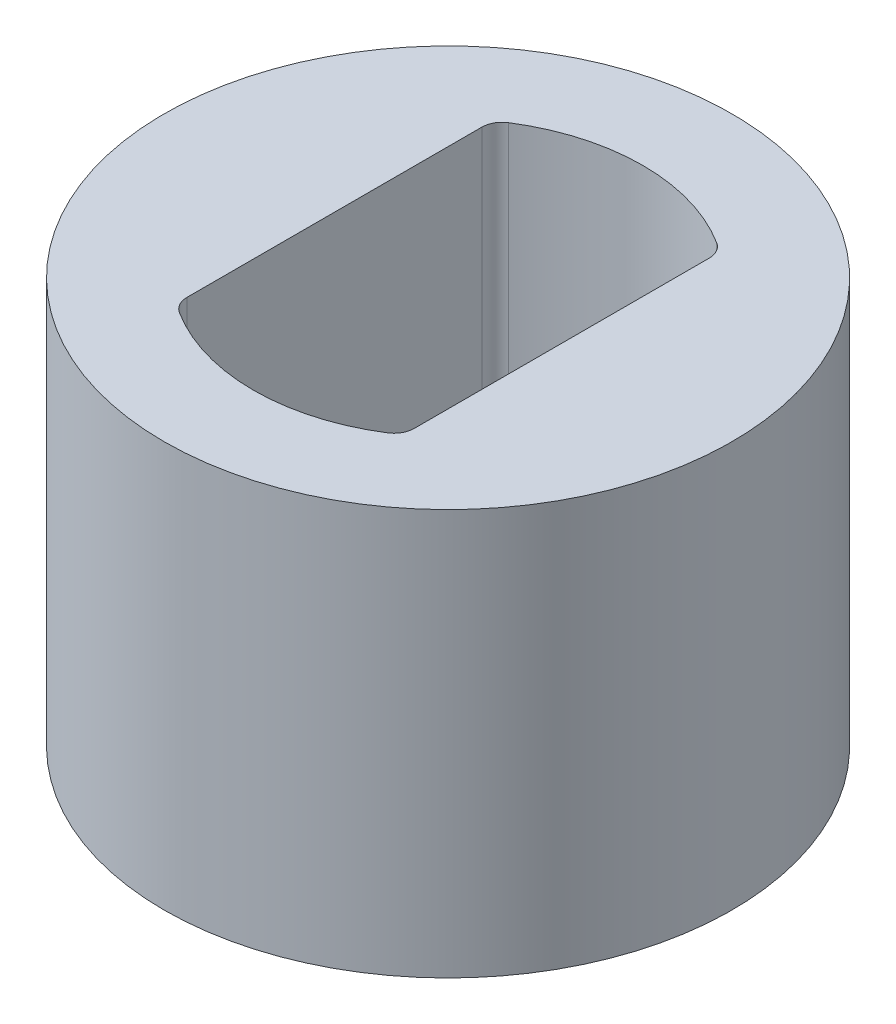
from build123d import *

# Parameters (mm, degrees)
SKETCH1_R           = 3.5
BOSS_EXTRUDE1_DEPTH = 5
CUT_EXTRUDE1_DEPTH  = 5
FILLET1_R           = 0.25


with BuildPart() as part:
    # Sketch1 → Boss-Extrude1 (new body)
    with BuildSketch(Plane(origin=(0, 0, 0), x_dir=(1, 0, 0), z_dir=(0, 1, 0))):
        with Locations(Location((0, 0, 0), (0, 0, 270))):
            Circle(SKETCH1_R)
    extrude(amount=BOSS_EXTRUDE1_DEPTH)

    # Sketch2 → Cut-Extrude1 (cut)
    with BuildSketch(Plane(origin=(0, 5, 0), x_dir=(1, 0, 0), z_dir=(0, 1, 0))):
        with BuildLine():
            Line((1.4, -1.949358869), (1.4, 1.949358869))
            ThreePointArc((1.4, 1.949358869), (0, 2.4), (-1.4, 1.949358869))
            Line((-1.4, 1.949358869), (-1.4, -1.949358869))
            ThreePointArc((-1.4, -1.949358869), (0, -2.4), (1.4, -1.949358869))
        make_face()
    extrude(amount=-CUT_EXTRUDE1_DEPTH, mode=Mode.SUBTRACT)

    # Fillet1
    fillet1_edges = [part.edges().sort_by_distance(p)[0] for p in [
        (1.4, 2.5, 1.949358869),
        (-1.4, 2.5, 1.949358869),
        (-1.4, 2.5, -1.949358869),
        (1.4, 2.5, -1.949358869),
    ]]
    fillet(fillet1_edges, radius=FILLET1_R)


solid = part.part
